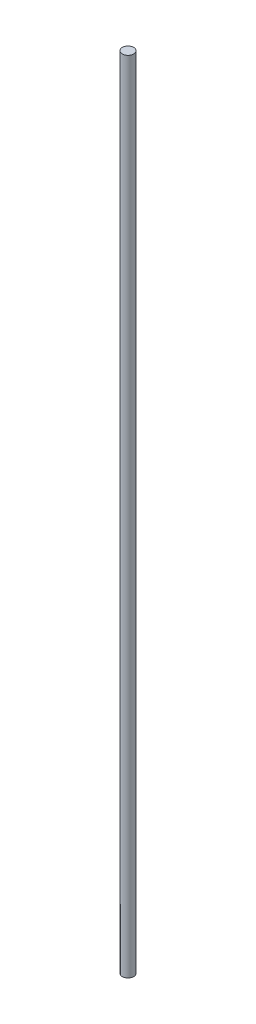
from build123d import *

# Parameters (mm, degrees)
SKETCH1_R           = 1
BOSS_EXTRUDE1_DEPTH = 140


with BuildPart() as part:
    # Sketch1 → Boss-Extrude1 (new body)
    with BuildSketch(Plane(origin=(0, 0, 0), x_dir=(1, 0, 0), z_dir=(0, 1, 0))):
        with Locations(Location((0, 0, 0), (0, 0, 270))):
            Circle(SKETCH1_R)
    extrude(amount=BOSS_EXTRUDE1_DEPTH)


solid = part.part
